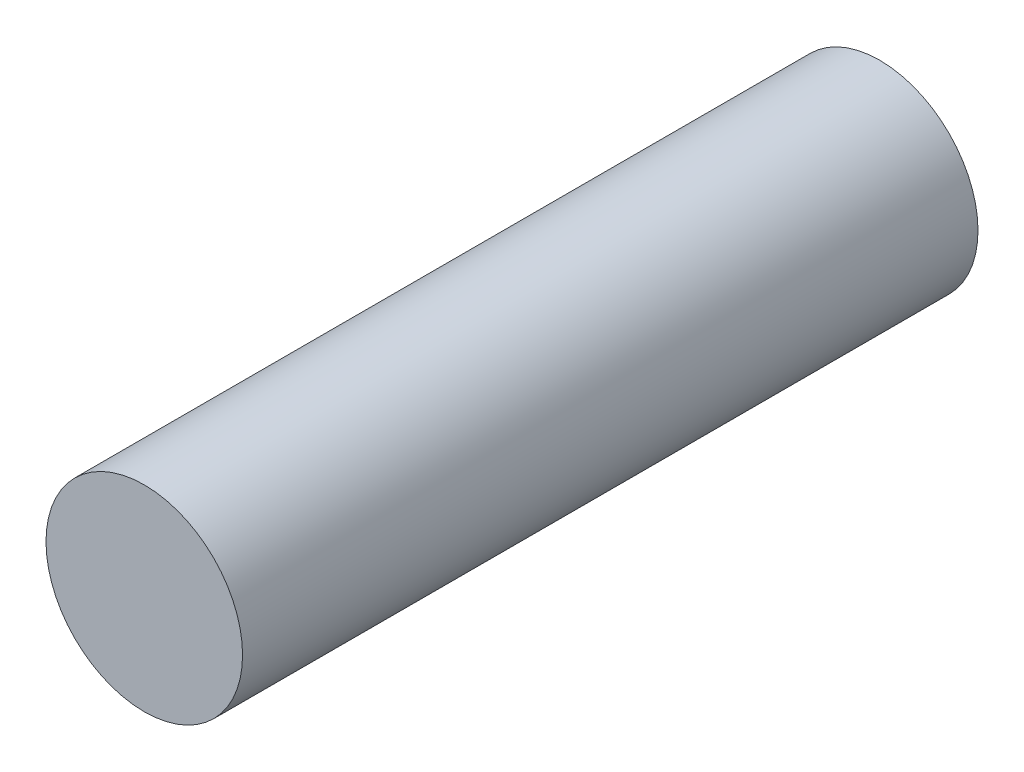
from build123d import *

# Parameters (mm, degrees)
SKETCH1_R           = 0.89
BOSS_EXTRUDE1_DEPTH = 6.66


with BuildPart() as part:
    # Sketch1 → Boss-Extrude1 (new body)
    with BuildSketch(Plane.XY):
        Circle(SKETCH1_R)
    extrude(amount=BOSS_EXTRUDE1_DEPTH)


solid = part.part
